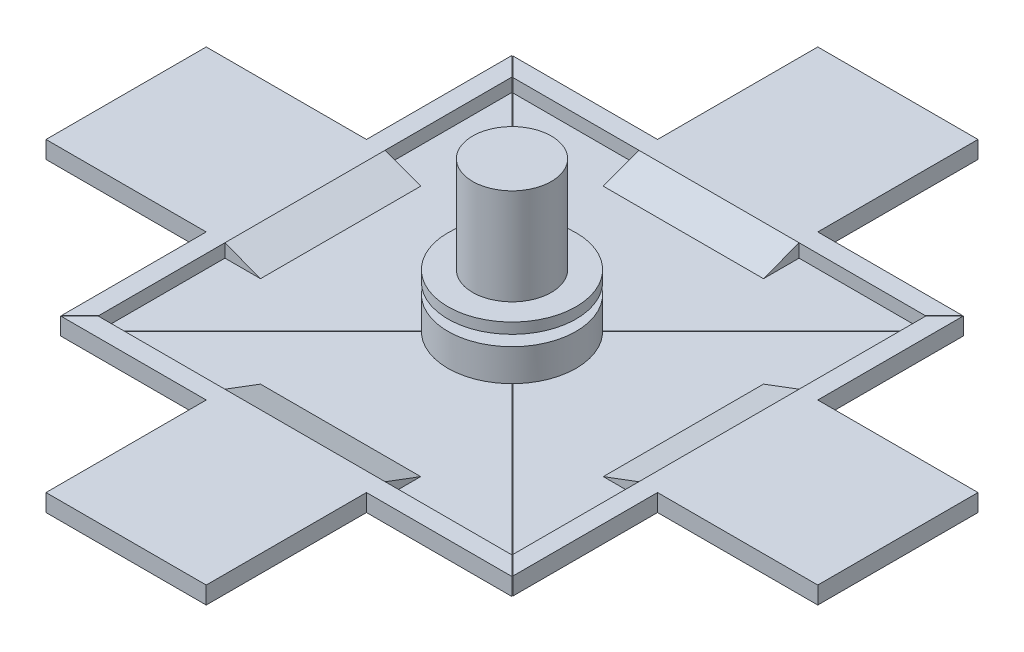
from build123d import *

# Parameters (mm, degrees)
PLYWOOD_BASE_DEPTH           = 19.05
FIELD_LAYOUT_3_W             = 1968.5
FIELD_LAYOUT_3_H             = 1968.5
RAISED_BASE_DEPTH            = 63.5
FIELD_LAYOUT_4_W             = 762
FIELD_LAYOUT_4_H             = 169.138249808
RAMP_EXTRUDE_DEPTH           = 63.5
CUT_RAMP_SLOPE_REACH         = 2880.042
COPY_RAMP_SLOPE_COUNT        = 4
SKETCH5_R                    = 304.8
BOSS_EXTRUDE1_DEPTH          = 254
CUT_EXTRUDE_THIN1_DEPTH      = 2608.693817341
CUT_EXTRUDE_THIN1_DEPTH_BACK = 2608.693817341
SKETCH6_R                    = 187.226802171
BOSS_EXTRUDE2_DEPTH          = 457.2
SKETCH7_W                    = 76.354251867
SKETCH7_H                    = 50.8


with BuildPart() as part:
    # Field Layout → Plywood Base (new body)
    with BuildSketch(Plane(origin=(0, 0, 0), x_dir=(1, 0, 0), z_dir=(0, 1, 0))):
        Polygon((-381, 1073.15), (-1073.15, 1073.15), (-1073.15, 381), (-1835.15, 381), (-1835.15, -381), (-1073.15, -381), (-1073.15, -1073.15), (-381, -1073.15), (-381, -1835.15), (381, -1835.15), (381, -1073.15), (1073.15, -1073.15), (1073.15, -381), (1835.15, -381), (1835.15, 381), (1073.15, 381), (1073.15, 1073.15), (381, 1073.15), (381, 1835.15), (-381, 1835.15), align=None)
    extrude(amount=-PLYWOOD_BASE_DEPTH)

    # Field Layout<3> → Raised Base (add)
    with BuildSketch(Plane(origin=(0, 0, 0), x_dir=(1, 0, 0), z_dir=(0, 1, 0))):
        Polygon((-381, 1073.15), (-1073.15, 1073.15), (-1073.15, 381), (-1835.15, 381), (-1835.15, -381), (-1073.15, -381), (-1073.15, -1073.15), (-381, -1073.15), (-381, -1835.15), (381, -1835.15), (381, -1073.15), (1073.15, -1073.15), (1073.15, -381), (1835.15, -381), (1835.15, 381), (1073.15, 381), (1073.15, 1073.15), (381, 1073.15), (381, 1835.15), (-381, 1835.15), align=None)
        Rectangle(FIELD_LAYOUT_3_W, FIELD_LAYOUT_3_H, mode=Mode.SUBTRACT)
    extrude(amount=RAISED_BASE_DEPTH)

    # Field Layout<4> → Ramp Extrude (add)
    with BuildSketch(Plane(origin=(0, 0, 0), x_dir=(1, 0, 0), z_dir=(0, 1, 0))):
        with Locations((0, -899.680875096)):
            Rectangle(FIELD_LAYOUT_4_W, FIELD_LAYOUT_4_H)
    ramp_extrude = extrude(amount=RAMP_EXTRUDE_DEPTH)

    # Sketch3 → Cut ramp slope (cut, up to next)
    with BuildSketch(Plane(origin=(381, 0, 0), x_dir=(0, 0, -1), z_dir=(1, 0, 0)), mode=Mode.PRIVATE) as cut_ramp_slope_sk1:
        Polygon((-815.111750192, 63.5), (-984.25, 63.5), (-815.111750192, 0), align=None)
    cut_ramp_slope_tool1 = extrude(cut_ramp_slope_sk1.sketch, amount=-CUT_RAMP_SLOPE_REACH, mode=Mode.PRIVATE) & part.part
    cut_ramp_slope = cut_ramp_slope_tool1.solids().sort_by_distance((381, 42.333333, 871.491167))[0]
    add(cut_ramp_slope, mode=Mode.SUBTRACT)

    # Copy Ramp Slope: Ramp Extrude, Cut ramp slope ×4 about axis
    copy_ramp_slope_axis = Axis((0, -19.05, 0), (0, -1, 0))
    add([ramp_extrude.rotate(copy_ramp_slope_axis, i * 360 / COPY_RAMP_SLOPE_COUNT) for i in range(1, COPY_RAMP_SLOPE_COUNT)])
    add([cut_ramp_slope.rotate(copy_ramp_slope_axis, i * 360 / COPY_RAMP_SLOPE_COUNT) for i in range(1, COPY_RAMP_SLOPE_COUNT)], mode=Mode.SUBTRACT)

    # Sketch4 → Cut-Extrude-Thin1 (cut, two sides: drawn at the far end of the back side and taken through both)
    with BuildSketch(Plane(origin=(0, 0, 0), x_dir=(1, 0, 0), z_dir=(0, 1, 0)).offset(-CUT_EXTRUDE_THIN1_DEPTH_BACK)):
        Polygon((-1073.15, -1073.15), (-984.25, -984.25), (984.25, 984.25), (1073.15, 1073.15), (1071.353948776, 1074.946051224), (982.453948776, 986.046051224), (-986.046051224, -982.453948776), (-1074.946051224, -1071.353948776), align=None)
        Polygon((-1073.15, 1073.15), (-984.25, 984.25), (984.25, -984.25), (1073.15, -1073.15), (1074.946051224, -1071.353948776), (986.046051224, -982.453948776), (-982.453948776, 986.046051224), (-1071.353948776, 1074.946051224), align=None)
    extrude(amount=CUT_EXTRUDE_THIN1_DEPTH + CUT_EXTRUDE_THIN1_DEPTH_BACK, mode=Mode.SUBTRACT)


with BuildPart() as body_2:
    # Sketch5 → Boss-Extrude1 (new body)
    with BuildSketch(Plane(origin=(0, 0, 0), x_dir=(1, 0, 0), z_dir=(0, 1, 0))):
        Circle(SKETCH5_R)
    extrude(amount=BOSS_EXTRUDE1_DEPTH)

    # Sketch6 → Boss-Extrude2 (add)
    with BuildSketch(Plane(origin=(0, 254, 0), x_dir=(1, 0, 0), z_dir=(0, 1, 0))):
        Circle(SKETCH6_R)
    extrude(amount=BOSS_EXTRUDE2_DEPTH)

    # Sketch7 → Cut-Revolve1 (revolve, cut)
    with BuildSketch(Plane.XY):
        with Locations((266.622874067, 177.8)):
            Rectangle(SKETCH7_W, SKETCH7_H)
    revolve(axis=Axis((0, 0, 0), (0, 1, 0)), mode=Mode.SUBTRACT)


with BuildPart() as cut_extrude_thin1_piece_1:
    # of the separate pieces the step leaves, piece 1, a body of its own (cut_extrude_thin1_pieces)
    add(part.part.solids().sort_by_distance((0, -19.05, 0))[0])


with BuildPart() as cut_extrude_thin1_piece_2:
    # of the separate pieces the step leaves, piece 2, a body of its own (cut_extrude_thin1_pieces)
    add(part.part.solids().sort_by_distance((-1073.15, -19.05, -1073.15))[0])


with BuildPart() as cut_extrude_thin1_piece_3:
    # of the separate pieces the step leaves, piece 3, a body of its own (cut_extrude_thin1_pieces)
    add(part.part.solids().sort_by_distance((1073.15, 63.5, -381))[0])


with BuildPart() as cut_extrude_thin1_piece_4:
    # of the separate pieces the step leaves, piece 4, a body of its own (cut_extrude_thin1_pieces)
    add(part.part.solids().sort_by_distance((-381, 63.5, -1073.15))[0])


solid = Compound([body_2.part, cut_extrude_thin1_piece_1.part, cut_extrude_thin1_piece_2.part, cut_extrude_thin1_piece_3.part, cut_extrude_thin1_piece_4.part])
